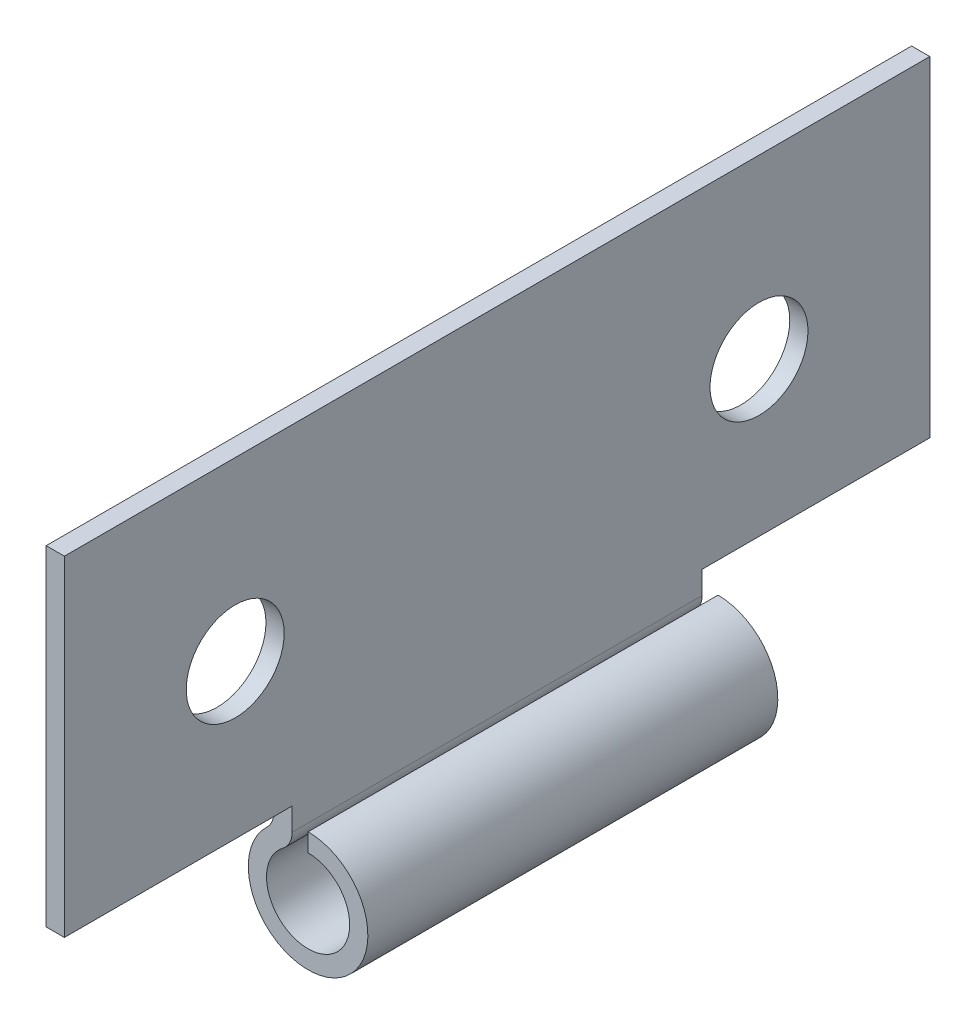
from build123d import *

# Parameters (mm, degrees)
BOSS_EXTRUDE1_DEPTH     = 38
CUT_EXTRUDE1_REACH      = 43.037
SKETCH2_R               = 2.15
CUT_EXTRUDE4_DEPTH      = 42.036691991
CUT_EXTRUDE4_DEPTH_BACK = 42.036691991
SKETCH3_W               = 10
SKETCH3_H               = 1
SKETCH3_H_2             = 4.881241343


with BuildPart() as part:
    # Sketch1 → Boss-Extrude1 (new body)
    with BuildSketch(Plane.XY):
        with BuildLine():
            Line((0.8, -0.368758657), (0.8, 15.131241343))
            Line((0.8, 15.131241343), (0, 15.131241343))
            Line((0, 15.131241343), (0, 0))
            ThreePointArc((0, 0), (-0.08085497, -0.393919299), (-0.310344828, -0.724137931))
            ThreePointArc((-0.310344828, -0.724137931), (2.474900525, -5.062251314), (1.5, 0))
            Line((1.5, 0), (1.5, -0.8))
            ThreePointArc((1.5, -0.8), (2.079032119, -4.355707025), (0.401769912, -1.167428159))
            ThreePointArc((0.401769912, -1.167428159), (0.69492176, -0.814981745), (0.8, -0.368758657))
        make_face()
    extrude(amount=BOSS_EXTRUDE1_DEPTH)

    # Sketch2 → Cut-Extrude1 (cut, up to next)
    with BuildSketch(Plane(origin=(0.8, 0, 0), x_dir=(0, 0, -1), z_dir=(1, 0, 0)), mode=Mode.PRIVATE) as cut_extrude1_sk1:
        with Locations((-30.5, 7.381241343)):
            Circle(SKETCH2_R)
    cut_extrude1_tool1 = extrude(cut_extrude1_sk1.sketch, amount=-CUT_EXTRUDE1_REACH, mode=Mode.PRIVATE) & part.part
    # Sketch2 → Cut-Extrude1 (cut, up to next)
    with BuildSketch(Plane(origin=(0.8, 0, 0), x_dir=(0, 0, -1), z_dir=(1, 0, 0)), mode=Mode.PRIVATE) as cut_extrude1_sk2:
        with Locations((-7.5, 7.381241343)):
            Circle(SKETCH2_R)
    cut_extrude1_tool2 = extrude(cut_extrude1_sk2.sketch, amount=-CUT_EXTRUDE1_REACH, mode=Mode.PRIVATE) & part.part
    add(cut_extrude1_tool1.solids().sort_by_distance((0.8, 7.381241, 30.5))[0], mode=Mode.SUBTRACT)
    add(cut_extrude1_tool2.solids().sort_by_distance((0.8, 7.381241, 7.5))[0], mode=Mode.SUBTRACT)

    # Sketch3 → Cut-Extrude4 (cut, two sides: drawn at the far end of the back side and taken through both)
    with BuildSketch(Plane(origin=(0.8, 0, 0), x_dir=(0, 0, -1), z_dir=(1, 0, 0)).offset(-CUT_EXTRUDE4_DEPTH_BACK)):
        with Locations((-33, 0.131241343)):
            Rectangle(SKETCH3_W, SKETCH3_H)
        with Locations((-33, -2.809379328)):
            Rectangle(SKETCH3_W, SKETCH3_H_2)
        with Locations((-5, 0.131241343)):
            Rectangle(SKETCH3_W, SKETCH3_H)
        with Locations((-5, -2.809379328)):
            Rectangle(SKETCH3_W, SKETCH3_H_2)
    extrude(amount=CUT_EXTRUDE4_DEPTH + CUT_EXTRUDE4_DEPTH_BACK, mode=Mode.SUBTRACT)


solid = part.part
